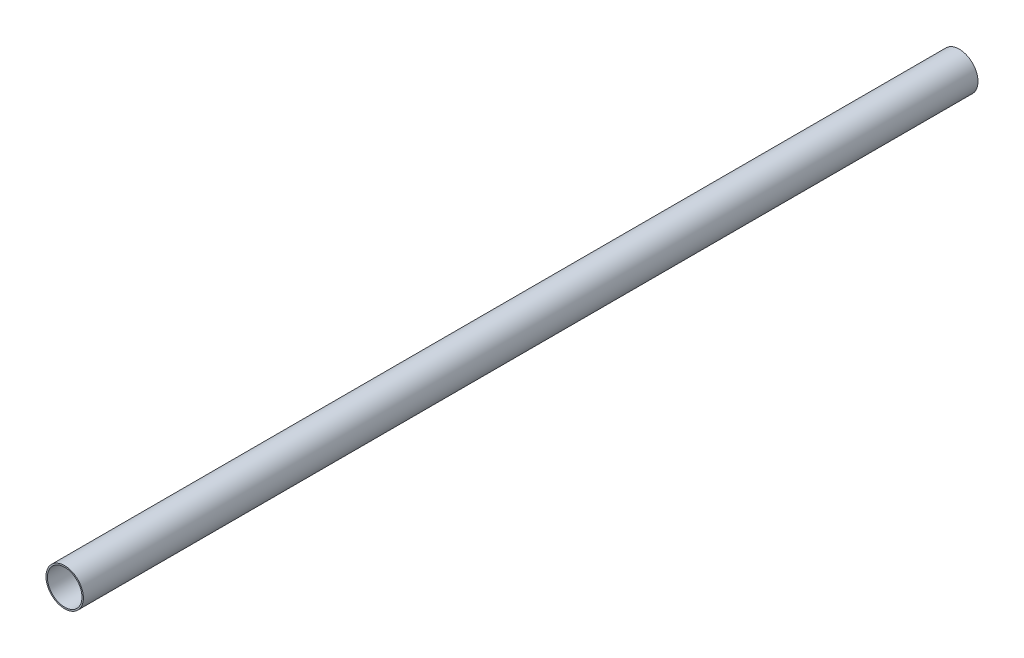
from build123d import *

# Parameters (mm, degrees)
SKETCH1_R           = 16
SKETCH1_R_2         = 14.8
BOSS_EXTRUDE1_DEPTH = 765


with BuildPart() as part:
    # Sketch1 → Boss-Extrude1 (new body)
    with BuildSketch(Plane.XY):
        Circle(SKETCH1_R)
        Circle(SKETCH1_R_2, mode=Mode.SUBTRACT)
    extrude(amount=BOSS_EXTRUDE1_DEPTH)


solid = part.part
